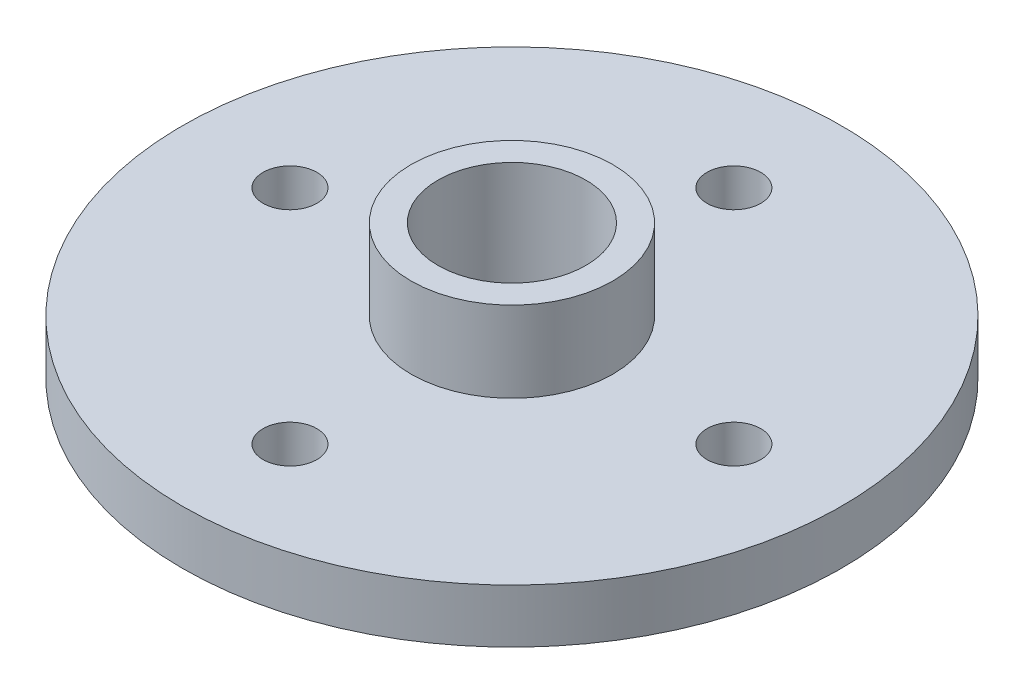
from build123d import *

# Parameters (mm, degrees)
SKETCH2_R           = 12.25
BOSS_EXTRUDE1_DEPTH = 2
SKETCH3_R           = 1
CUT_EXTRUDE1_DEPTH  = 18.439180027
SKETCH4_R           = 3.75
BOSS_EXTRUDE2_DEPTH = 3
SKETCH5_R           = 1.5
CUT_EXTRUDE2_DEPTH  = 19.03122292
SKETCH6_R           = 2.75
CUT_EXTRUDE3_DEPTH  = 4.5


with BuildPart() as part:
    # Sketch2 → Boss-Extrude1 (new body)
    with BuildSketch(Plane(origin=(0, 0, 0), x_dir=(1, 0, 0), z_dir=(0, 1, 0))):
        with Locations(Location((0, 0, 0), (0, 0, 270))):
            Circle(SKETCH2_R)
    extrude(amount=BOSS_EXTRUDE1_DEPTH)

    # Sketch3 → Cut-Extrude1 (cut, through all)
    with BuildSketch(Plane(origin=(0, 2, 0), x_dir=(1, 0, 0), z_dir=(0, 1, 0))):
        with Locations(Location((0, 8.25, 0), (0, 0, 270))):
            Circle(SKETCH3_R)
        with Locations(Location((8.25, 0, 0), (0, 0, 270))):
            Circle(SKETCH3_R)
        with Locations(Location((0, -8.25, 0), (0, 0, 90))):
            Circle(SKETCH3_R)
        with Locations(Location((-8.25, 0, 0), (0, 0, 90))):
            Circle(SKETCH3_R)
    extrude(amount=-CUT_EXTRUDE1_DEPTH, mode=Mode.SUBTRACT)

    # Sketch4 → Boss-Extrude2 (add)
    with BuildSketch(Plane(origin=(0, 2, 0), x_dir=(1, 0, 0), z_dir=(0, 1, 0))):
        with Locations(Location((0, 0, 0), (0, 0, 270))):
            Circle(SKETCH4_R)
    extrude(amount=BOSS_EXTRUDE2_DEPTH)

    # Sketch5 → Cut-Extrude2 (cut, through all)
    with BuildSketch(Plane(origin=(0, 5, 0), x_dir=(1, 0, 0), z_dir=(0, 1, 0))):
        with Locations(Location((0, 0, 0), (0, 0, 270))):
            Circle(SKETCH5_R)
    extrude(amount=-CUT_EXTRUDE2_DEPTH, mode=Mode.SUBTRACT)

    # Sketch6 → Cut-Extrude3 (cut)
    with BuildSketch(Plane(origin=(0, 5, 0), x_dir=(1, 0, 0), z_dir=(0, 1, 0))):
        with Locations(Location((0, 0, 0), (0, 0, 270))):
            Circle(SKETCH6_R)
    extrude(amount=-CUT_EXTRUDE3_DEPTH, mode=Mode.SUBTRACT)


solid = part.part
